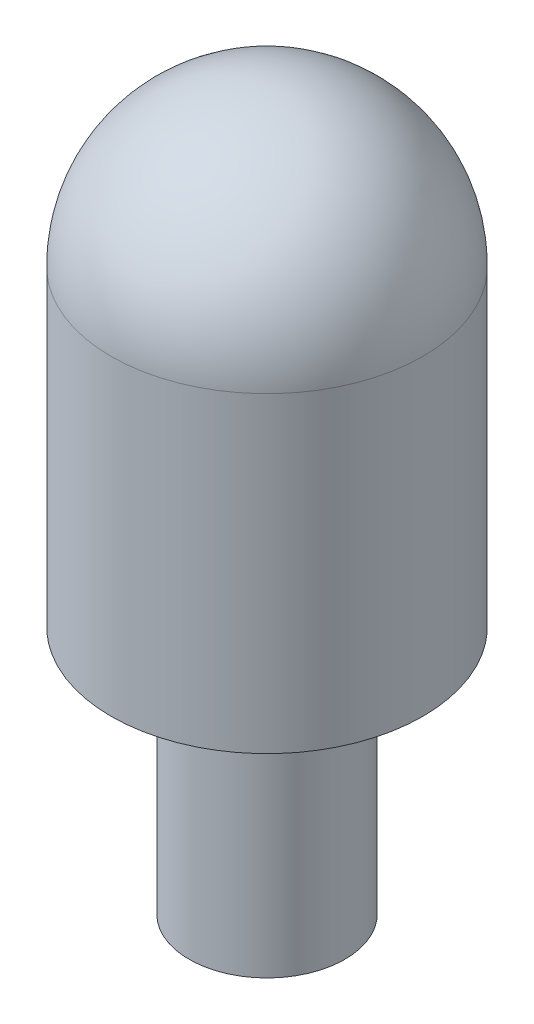
from build123d import *


with BuildPart() as part:
    # 草图1 → 旋转1 (revolve)
    with BuildSketch(Plane(origin=(0, 0, 0), x_dir=(0, 0, -1), z_dir=(1, 0, 0))):
        with BuildLine():
            Line((5, 18), (5, 8))
            Line((5, 8), (2.5, 8))
            Line((2.5, 8), (2.5, 0))
            Line((2.5, 0), (0, 0))
            Line((0, 0), (0, 23))
            ThreePointArc((0, 23), (3.535533906, 21.535533906), (5, 18))
        make_face()
    revolve(axis=Axis((0, 0, 0), (0, 1, 0)))


solid = part.part
